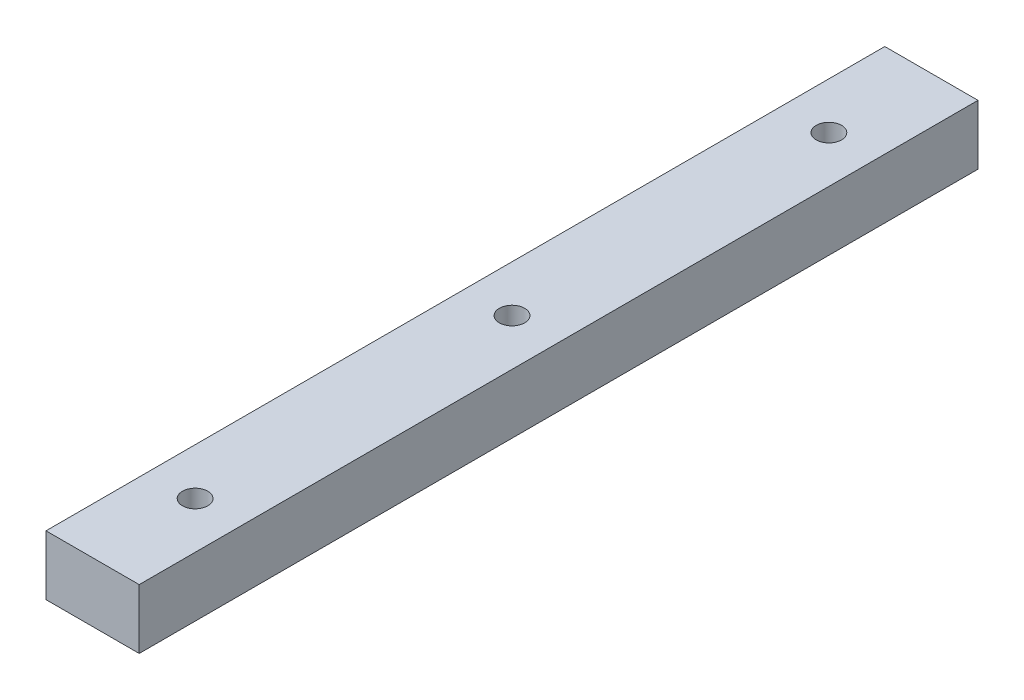
from build123d import *

# Parameters (mm, degrees)
SKETCH1_W           = 25
SKETCH1_H           = 225
BOSS_EXTRUDE1_DEPTH = 16
SKETCH2_R           = 8.5
CUT_EXTRUDE1_DEPTH  = 5
M8_TAPPED_HOLE1_D   = 6.8


with BuildPart() as part:
    # Sketch1 → Boss-Extrude1 (new body)
    with BuildSketch(Plane(origin=(0, 0, 0), x_dir=(1, 0, 0), z_dir=(0, 1, 0))):
        Rectangle(SKETCH1_W, SKETCH1_H)
    extrude(amount=-BOSS_EXTRUDE1_DEPTH)

    # Sketch2 → Cut-Extrude1 (cut)
    with BuildSketch(Plane.XZ.offset(16)):
        with Locations(Location((0, 100, 0), (0, 0, 270))):
            Circle(SKETCH2_R)
        with Locations(Location((0, -100, 0), (0, 0, 270))):
            Circle(SKETCH2_R)
    extrude(amount=-CUT_EXTRUDE1_DEPTH, mode=Mode.SUBTRACT)

    # M8 Tapped Hole1 (through all)
    with Locations(Plane(origin=(0, 0, 0), x_dir=(1, 0, 0), z_dir=(0, 1, 0))):
        with Locations((0, 85), (0, 0), (0, -85)):
            Hole(M8_TAPPED_HOLE1_D / 2)


solid = part.part
